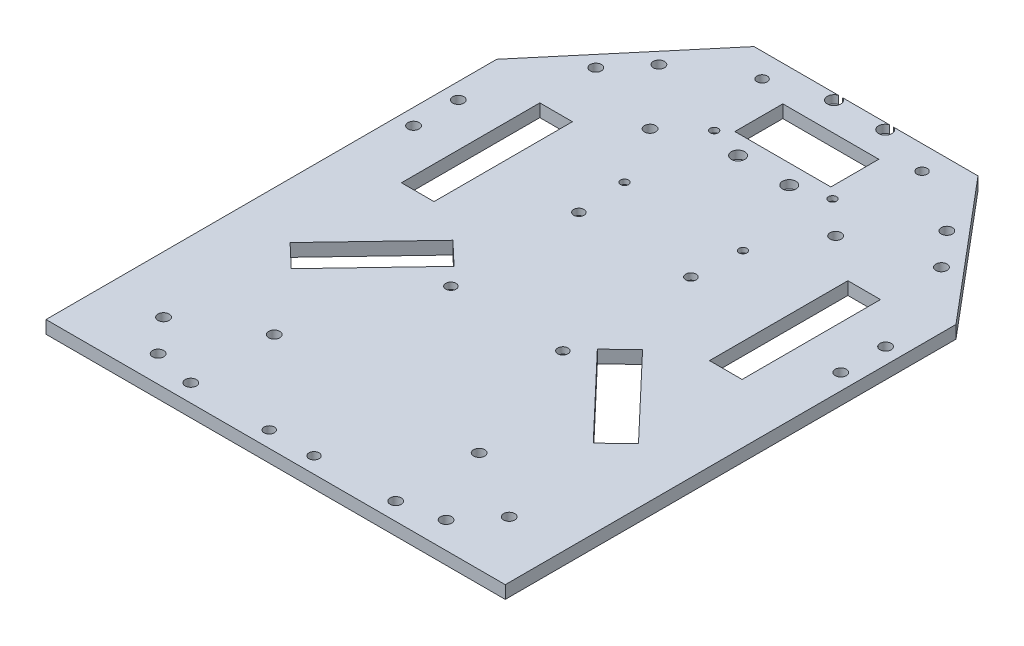
from build123d import *

# Parameters (mm, degrees)
SKETCH1_W           = 70
SKETCH1_H           = 184.5
BOSS_EXTRUDE1_DEPTH = 4
SKETCH2_R           = 1.6
SKETCH2_R_2         = 1.1
SKETCH2_R_3         = 1.75
SKETCH2_W           = 30
SKETCH2_H           = 15
CUT_EXTRUDE1_DEPTH  = 10
SKETCH3_W           = 143.549952052
SKETCH3_H           = 140.880717629
BOSS_EXTRUDE2_DEPTH = 4
SKETCH4_R           = 1.75
BOSS_EXTRUDE3_DEPTH = 4
SKETCH5_R           = 1.75
CUT_EXTRUDE2_DEPTH  = 6
CUT_EXTRUDE4_REACH  = 118.982
SKETCH8_R           = 2.1
CUT_EXTRUDE7_DEPTH  = 2.5
SKETCH9_R           = 1.75
CUT_EXTRUDE8_DEPTH  = 12
SKETCH10_R          = 1.75
SKETCH10_W          = 10.192778524
SKETCH10_H          = 43.257157637
CUT_EXTRUDE9_DEPTH  = 10
SKETCH11_R          = 1.6
CUT_EXTRUDE10_DEPTH = 10
CUT_EXTRUDE11_DEPTH = 2
CUT_EXTRUDE12_DEPTH = 12
SKETCH14_R          = 1.6
CUT_EXTRUDE13_DEPTH = 12
SKETCH15_R          = 2.5
CUT_EXTRUDE14_DEPTH = 2.5


with BuildPart() as part:
    # Sketch1 → Boss-Extrude1 (new body)
    with BuildSketch(Plane(origin=(0, 0, 0), x_dir=(1, 0, 0), z_dir=(0, 1, 0))):
        Rectangle(SKETCH1_W, SKETCH1_H)
    extrude(amount=BOSS_EXTRUDE1_DEPTH)

    # Sketch2 → Cut-Extrude1 (cut)
    with BuildSketch(Plane(origin=(0, 0, 0), x_dir=(-1, 0, 0), z_dir=(0, -1, 0))):
        with Locations(Location((25, 84.75, 0), (0, 0, 90))):
            Circle(SKETCH2_R)
        with Locations(Location((-25, 84.75, 0), (0, 0, 90))):
            Circle(SKETCH2_R)
        with Locations(Location((-8, 90.25, 0), (0, 0, 90))):
            Circle(SKETCH2_R_2)
        with Locations(Location((8, 90.25, 0), (0, 0, 90))):
            Circle(SKETCH2_R_2)
        with Locations(Location((-8, 60.25, 0), (0, 0, 90))):
            Circle(SKETCH2_R_2)
        with Locations(Location((8, 60.25, 0), (0, 0, 90))):
            Circle(SKETCH2_R_2)
        with Locations(Location((29, 53.75, 0), (0, 0, 90))):
            Circle(SKETCH2_R_3)
        with Locations(Location((-29, 53.75, 0), (0, 0, 90))):
            Circle(SKETCH2_R_3)
        with Locations((0, 73.75)):
            Rectangle(SKETCH2_W, SKETCH2_H)
    extrude(amount=-CUT_EXTRUDE1_DEPTH, mode=Mode.SUBTRACT)

    # Sketch3 → Boss-Extrude2 (add)
    with BuildSketch(Plane(origin=(0, 4, 0), x_dir=(1, 0, 0), z_dir=(0, 1, 0))):
        with Locations((0, -21.847654169)):
            Rectangle(SKETCH3_W, SKETCH3_H)
    extrude(amount=-BOSS_EXTRUDE2_DEPTH)

    # Sketch4 → Boss-Extrude3 (add)
    # profile 1 of 2: a face of its own
    with BuildSketch(Plane(origin=(0, 4, 0), x_dir=(1, 0, 0), z_dir=(0, 1, 0))):
        Polygon((-35, 92.25), (-71.774976026, 48.592704646), (-35, 48.592704646), align=None)
        with Locations(Location((-45, 72.508621997, 0), (0, 0, 90))):
            Circle(SKETCH4_R, mode=Mode.SUBTRACT)
        with Locations(Location((-54.019469919, 61.801187085, 0), (0, 0, 270))):
            Circle(SKETCH4_R, mode=Mode.SUBTRACT)
    # profile 2 of 2: a face of its own
    with BuildSketch(Plane(origin=(0, 4, 0), x_dir=(1, 0, 0), z_dir=(0, 1, 0))):
        Polygon((71.774976026, 48.592704646), (35, 48.592704646), (35, 92.25), align=None)
        with Locations(Location((45, 72.508621997, 0), (0, 0, 270))):
            Circle(SKETCH4_R, mode=Mode.SUBTRACT)
        with Locations(Location((54.019469919, 61.801187085, 0), (0, 0, 90))):
            Circle(SKETCH4_R, mode=Mode.SUBTRACT)
    extrude(amount=-BOSS_EXTRUDE3_DEPTH)

    # Sketch5 → Cut-Extrude2 (cut)
    with BuildSketch(Plane(origin=(0, 4, 0), x_dir=(1, 0, 0), z_dir=(0, 1, 0))):
        with Locations(Location((32.024976026, -86.788012983, 0), (0, 0, 270))):
            Circle(SKETCH5_R)
        with Locations(Location((-32.024976026, -86.788012983, 0), (0, 0, 90))):
            Circle(SKETCH5_R)
    extrude(amount=-CUT_EXTRUDE2_DEPTH, mode=Mode.SUBTRACT)

    # Sketch7 → Cut-Extrude4 (cut, up to next)
    with BuildSketch(Plane(origin=(0, 4, 0), x_dir=(1, 0, 0), z_dir=(0, 1, 0)), mode=Mode.PRIVATE) as cut_extrude4_sk1:
        Polygon((-29.63871425, -7.235955991), (-22.392957727, -14.127908719), (-47.203987548, -40.212632203), (-54.449744071, -33.320679475), align=None)
    cut_extrude4_tool1 = extrude(cut_extrude4_sk1.sketch, amount=-CUT_EXTRUDE4_REACH, mode=Mode.PRIVATE) & part.part
    # Sketch7 → Cut-Extrude4 (cut, up to next)
    with BuildSketch(Plane(origin=(0, 4, 0), x_dir=(1, 0, 0), z_dir=(0, 1, 0)), mode=Mode.PRIVATE) as cut_extrude4_sk2:
        Polygon((54.449744071, -33.320679475), (29.63871425, -7.235955991), (22.392957727, -14.127908719), (47.203987548, -40.212632203), align=None)
    cut_extrude4_tool2 = extrude(cut_extrude4_sk2.sketch, amount=-CUT_EXTRUDE4_REACH, mode=Mode.PRIVATE) & part.part
    add(cut_extrude4_tool1.solids().sort_by_distance((-38.421351, 4, 23.724294))[0], mode=Mode.SUBTRACT)
    add(cut_extrude4_tool2.solids().sort_by_distance((38.421351, 4, 23.724294))[0], mode=Mode.SUBTRACT)

    # Sketch8 → Cut-Extrude7 (cut)
    with BuildSketch(Plane(origin=(0, 4, 0), x_dir=(1, 0, 0), z_dir=(0, 1, 0))):
        with Locations((-8, 90.25)):
            Circle(SKETCH8_R)
        with Locations((8, 90.25)):
            Circle(SKETCH8_R)
        with Locations(Location((-8, 60.25, 0), (0, 0, 270))):
            Circle(SKETCH8_R)
        with Locations(Location((8, 60.25, 0), (0, 0, 270))):
            Circle(SKETCH8_R)
    extrude(amount=-CUT_EXTRUDE7_DEPTH, mode=Mode.SUBTRACT)

    # Sketch9 → Cut-Extrude8 (cut)
    with BuildSketch(Plane(origin=(0, 4, 0), x_dir=(1, 0, 0), z_dir=(0, 1, 0))):
        with Locations(Location((-32.024976026, -60.698012983, 0), (0, 0, 270))):
            Circle(SKETCH9_R)
        with Locations(Location((32.024976026, -60.698012983, 0), (0, 0, 90))):
            Circle(SKETCH9_R)
    extrude(amount=-CUT_EXTRUDE8_DEPTH, mode=Mode.SUBTRACT)

    # Sketch10 → Cut-Extrude9 (cut)
    with BuildSketch(Plane(origin=(0, 4, 0), x_dir=(1, 0, 0), z_dir=(0, 1, 0))):
        with Locations(Location((-66.774976026, 31.592704646, 0), (0, 0, 270))):
            Circle(SKETCH10_R)
        with Locations(Location((-66.774976026, 17.592704646, 0), (0, 0, 270))):
            Circle(SKETCH10_R)
        with Locations(Location((66.774976026, 31.592704646, 0), (0, 0, 90))):
            Circle(SKETCH10_R)
        with Locations(Location((66.774976026, 17.592704646, 0), (0, 0, 90))):
            Circle(SKETCH10_R)
        with Locations(Location((-54.019469919, 61.801187085, 0), (0, 0, 270))):
            Circle(SKETCH10_R)
        with Locations(Location((-45, 72.508621997, 0), (0, 0, 90))):
            Circle(SKETCH10_R)
        with Locations(Location((45, 72.508621997, 0), (0, 0, 270))):
            Circle(SKETCH10_R)
        with Locations(Location((54.019469919, 61.801187085, 0), (0, 0, 90))):
            Circle(SKETCH10_R)
        with Locations(Location((54.019469919, -73.301187085, 0), (0, 0, 90))):
            Circle(SKETCH10_R)
        with Locations(Location((45, -84.008621997, 0), (0, 0, 90))):
            Circle(SKETCH10_R)
        with Locations(Location((-45, -84.008621997, 0), (0, 0, 90))):
            Circle(SKETCH10_R)
        with Locations(Location((-54.019469919, -73.301187085, 0), (0, 0, 90))):
            Circle(SKETCH10_R)
        with Locations((48.142044334, 21.901087456)):
            Rectangle(SKETCH10_W, SKETCH10_H)
        with Locations((-48.142044334, 21.901087456)):
            Rectangle(SKETCH10_W, SKETCH10_H)
    extrude(amount=-CUT_EXTRUDE9_DEPTH, mode=Mode.SUBTRACT)

    # Sketch11 → Cut-Extrude10 (cut)
    with BuildSketch(Plane(origin=(0, 4, 0), x_dir=(1, 0, 0), z_dir=(0, 1, 0))):
        with Locations(Location((-17.5, 20, 0), (0, 0, 270))):
            Circle(SKETCH11_R)
        with Locations(Location((17.5, 20, 0), (0, 0, 270))):
            Circle(SKETCH11_R)
        with Locations(Location((-17.5, -20, 0), (0, 0, 270))):
            Circle(SKETCH11_R)
        with Locations(Location((17.5, -20, 0), (0, 0, 270))):
            Circle(SKETCH11_R)
    extrude(amount=-CUT_EXTRUDE10_DEPTH, mode=Mode.SUBTRACT)

    # Sketch12 → Cut-Extrude11 (cut)
    with BuildSketch(Plane.XZ):
        Polygon((-14.65, -21.645448267), (-14.65, -18.354551733), (-17.5, -16.709103466), (-20.35, -18.354551733), (-20.35, -21.645448267), (-17.5, -23.290896534), align=None)
        Polygon((17.5, -23.290896534), (20.35, -21.645448267), (20.35, -18.354551733), (17.5, -16.709103466), (14.65, -18.354551733), (14.65, -21.645448267), align=None)
        Polygon((-17.5, 16.709103466), (-14.65, 18.354551733), (-14.65, 21.645448267), (-17.5, 23.290896534), (-20.35, 21.645448267), (-20.35, 18.354551733), align=None)
        Polygon((17.5, 23.290896534), (14.65, 21.645448267), (14.65, 18.354551733), (17.5, 16.709103466), (20.35, 18.354551733), (20.35, 21.645448267), align=None)
    extrude(amount=-CUT_EXTRUDE11_DEPTH, mode=Mode.SUBTRACT)

    # Sketch13 → Cut-Extrude12 (cut)
    with BuildSketch(Plane(origin=(0, 4, 0), x_dir=(1, 0, 0), z_dir=(0, 1, 0))):
        with BuildLine():
            ThreePointArc((-17.25, 35.272622101), (-17.616116524, 36.156505577), (-18.5, 36.522622101))
            Line((-18.5, 36.522622101), (-18.5, 35.272622101))
            Line((-18.5, 35.272622101), (-17.25, 35.272622101))
        make_face()
        with BuildLine():
            Line((-18.5, 35.272622101), (-18.5, 36.522622101))
            ThreePointArc((-18.5, 36.522622101), (-19.383883476, 34.388738624), (-17.25, 35.272622101))
            Line((-17.25, 35.272622101), (-18.5, 35.272622101))
        make_face()
        with BuildLine():
            ThreePointArc((19.75, 35.272622101), (19.383883476, 36.156505577), (18.5, 36.522622101))
            Line((18.5, 36.522622101), (18.5, 35.272622101))
            Line((18.5, 35.272622101), (17.25, 35.272622101))
            ThreePointArc((17.25, 35.272622101), (18.5, 34.022622101), (19.75, 35.272622101))
        make_face()
        with BuildLine():
            Line((18.5, 35.272622101), (18.5, 36.522622101))
            ThreePointArc((18.5, 36.522622101), (17.616116524, 36.156505577), (17.25, 35.272622101))
            Line((17.25, 35.272622101), (18.5, 35.272622101))
        make_face()
        with BuildLine():
            ThreePointArc((19.75, 63.272622101), (18.5, 64.522622101), (17.25, 63.272622101))
            Line((17.25, 63.272622101), (18.5, 63.272622101))
            Line((18.5, 63.272622101), (18.5, 62.022622101))
            ThreePointArc((18.5, 62.022622101), (19.383883476, 62.388738624), (19.75, 63.272622101))
        make_face()
        with BuildLine():
            Line((18.5, 63.272622101), (17.25, 63.272622101))
            ThreePointArc((17.25, 63.272622101), (17.616116524, 62.388738624), (18.5, 62.022622101))
            Line((18.5, 62.022622101), (18.5, 63.272622101))
        make_face()
        with BuildLine():
            Line((-18.5, 62.022622101), (-18.5, 63.272622101))
            Line((-18.5, 63.272622101), (-17.25, 63.272622101))
            ThreePointArc((-17.25, 63.272622101), (-19.383883476, 64.156505577), (-18.5, 62.022622101))
        make_face()
        with BuildLine():
            Line((-17.25, 63.272622101), (-18.5, 63.272622101))
            Line((-18.5, 63.272622101), (-18.5, 62.022622101))
            ThreePointArc((-18.5, 62.022622101), (-17.616116524, 62.388738624), (-17.25, 63.272622101))
        make_face()
    extrude(amount=-CUT_EXTRUDE12_DEPTH, mode=Mode.SUBTRACT)

    # Sketch14 → Cut-Extrude13 (cut)
    with BuildSketch(Plane(origin=(0, 4, 0), x_dir=(1, 0, 0), z_dir=(0, 1, 0))):
        with Locations(Location((-7, -87.288012983, 0), (0, 0, 270))):
            Circle(SKETCH14_R)
        with Locations(Location((7, -87.288012983, 0), (0, 0, 90))):
            Circle(SKETCH14_R)
    extrude(amount=-CUT_EXTRUDE13_DEPTH, mode=Mode.SUBTRACT)

    # Sketch15 → Cut-Extrude14 (cut)
    with BuildSketch(Plane.XZ):
        with Locations(Location((-18.5, -35.272622101, 0), (0, 0, 270))):
            Circle(SKETCH15_R)
        with Locations(Location((18.5, -35.272622101, 0), (0, 0, 270))):
            Circle(SKETCH15_R)
        with Locations(Location((-18.5, -63.272622101, 0), (0, 0, 270))):
            Circle(SKETCH15_R)
        with Locations(Location((18.5, -63.272622101, 0), (0, 0, 270))):
            Circle(SKETCH15_R)
    extrude(amount=-CUT_EXTRUDE14_DEPTH, mode=Mode.SUBTRACT)


solid = part.part
